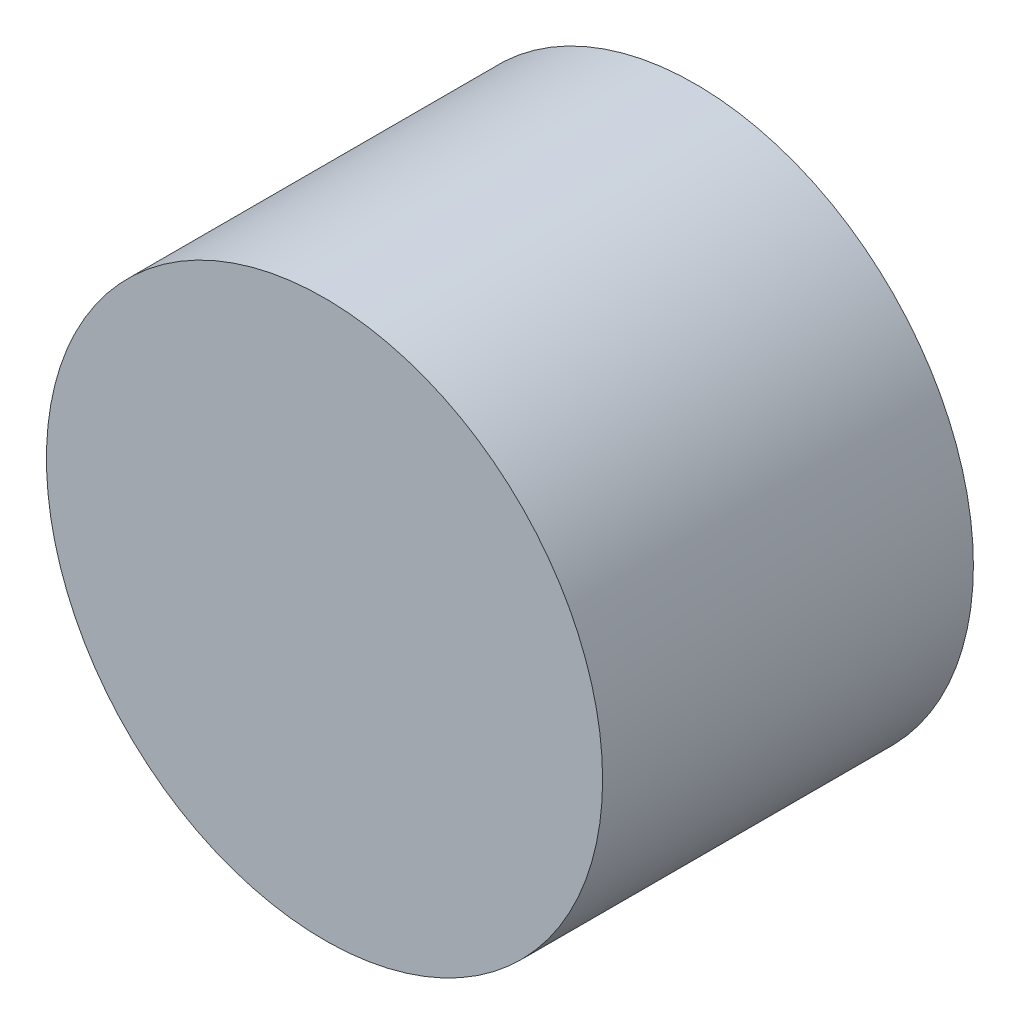
from build123d import *

# Parameters (mm, degrees)
CROQUIS1_R                 = 12
SALIENTE_EXTRUIR1_DEPTH    = 16
CORTAR_EXTRUIR1_DEPTH      = 1
CORTAR_EXTRUIR1_DEPTH_BACK = 9
CROQUIS3_W                 = 6
CROQUIS3_H                 = 12


with BuildPart() as part:
    # Croquis1 → Saliente-Extruir1 (new body)
    with BuildSketch(Plane.XY):
        Circle(CROQUIS1_R)
    extrude(amount=SALIENTE_EXTRUIR1_DEPTH)

    # Croquis3 → Cortar-Extruir1 (cut, two sides: drawn at the far end of the back side and taken through both)
    with BuildSketch(Plane.ZY.offset(12).offset(-CORTAR_EXTRUIR1_DEPTH_BACK)):
        with Locations((4, 0)):
            Rectangle(CROQUIS3_W, CROQUIS3_H)
    extrude(amount=CORTAR_EXTRUIR1_DEPTH + CORTAR_EXTRUIR1_DEPTH_BACK, mode=Mode.SUBTRACT)


solid = part.part
